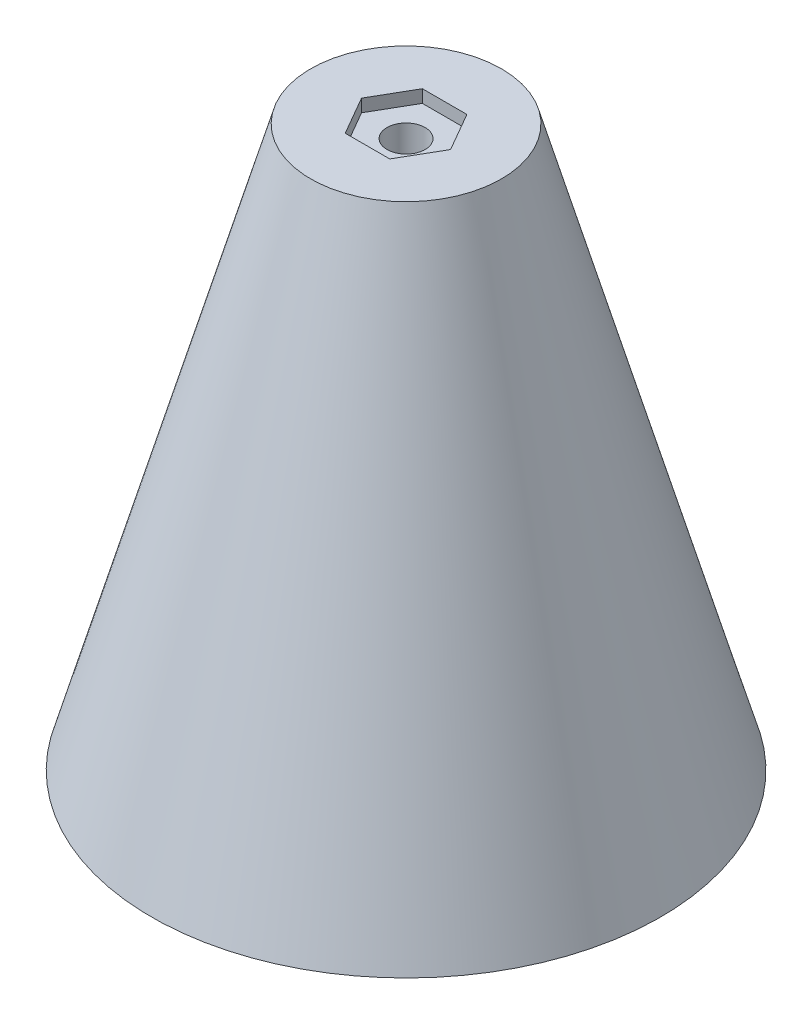
from build123d import *

# Parameters (mm, degrees)
SKETCH_4_R          = 1.5
CUT_EXTRUDE_1_DEPTH = 10
CHAMFER_1_SIZE      = 0.5
CUT_EXTRUDE_2_DEPTH = 1


with BuildPart() as part:
    # 草图3 → 旋转1 (revolve)
    with BuildSketch(Plane(origin=(0, 0, 0), x_dir=(0, 0, -1), z_dir=(1, 0, 0)), mode=Mode.PRIVATE) as revolve_1_sk:
        Polygon((-7.5, 0), (0, 0), (0, -4), (-4.636363636, -4), (-16, -44), (-20, -44), align=None)
    revolve(revolve_1_sk.sketch.rotate(Axis((0, 28.450677981, 0), (0, 1, 0)), 180), axis=Axis((0, 28.450677981, 0), (0, 1, 0)))

    # 草图4 → 切除-拉伸1 (cut)
    with BuildSketch(Plane(origin=(0, 0, 0), x_dir=(1, 0, 0), z_dir=(0, 1, 0))):
        with Locations(Location((0, 0, 0), (0, 0, 270))):
            Circle(SKETCH_4_R)
    extrude(amount=-CUT_EXTRUDE_1_DEPTH, mode=Mode.SUBTRACT)

    # 倒角1
    chamfer_1_edges = [part.edges().sort_by_distance(p)[0] for p in [
        (0, -4, -1.5),
    ]]
    chamfer(chamfer_1_edges, length=CHAMFER_1_SIZE)

    # 草图5 → 切除-拉伸2 (cut)
    with BuildSketch(Plane(origin=(0, 0, 0), x_dir=(1, 0, 0), z_dir=(0, 1, 0))):
        Polygon((3.5, 0), (1.75, 3.031088913), (-1.75, 3.031088913), (-3.5, 0), (-1.75, -3.031088913), (1.75, -3.031088913), align=None)
    extrude(amount=-CUT_EXTRUDE_2_DEPTH, mode=Mode.SUBTRACT)


solid = part.part
